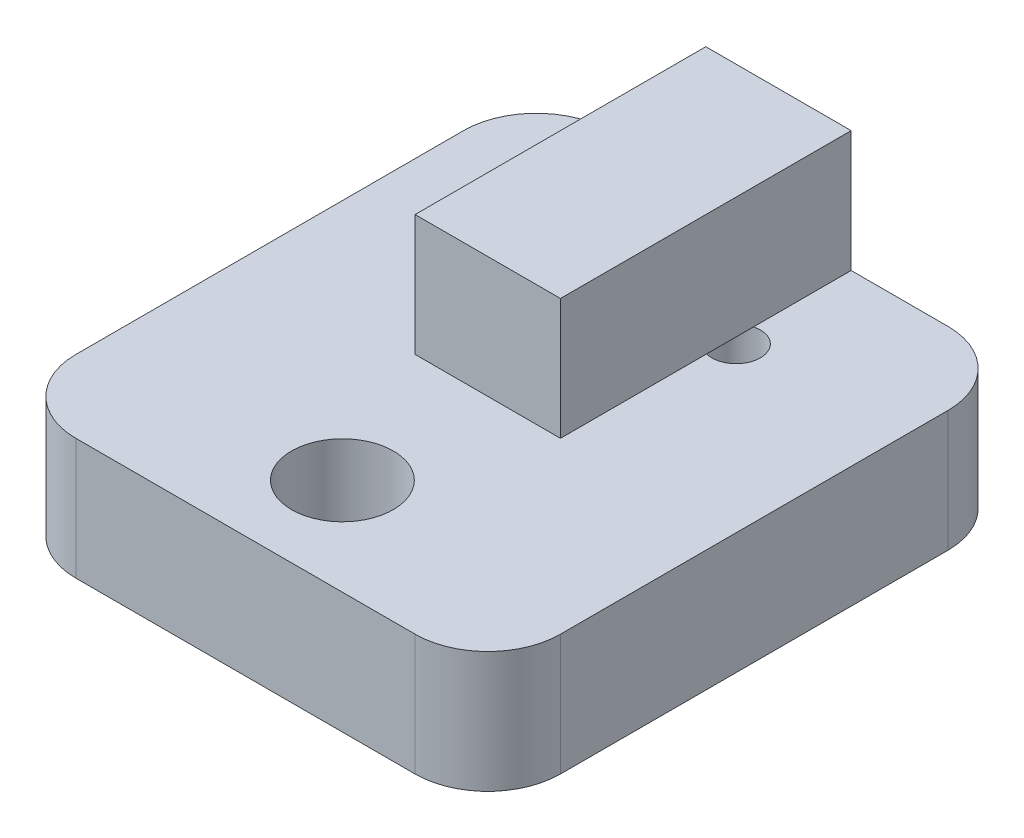
from build123d import *

# Parameters (mm, degrees)
SKETCH_1_R      = 2.1
EXTRUDE_1_DEPTH = 5
EXTRUDE_START   = 5
SKETCH_1_3_W    = 6
SKETCH_1_3_H    = 12
EXTRUDE_2_DEPTH = 5
FILLET_2_R      = 3


with BuildPart() as part:
    # 草图1 → 凸台-拉伸1 (new body)
    # profile 1 of 2: a face of its own
    with BuildSketch(Plane(origin=(0, 0, 0), x_dir=(1, 0, 0), z_dir=(0, 1, 0))):
        with BuildLine():
            Line((0, 22), (0, 0))
            Line((0, 0), (20, 0))
            Line((20, 0), (20, 22))
            Line((20, 22), (13, 22))
            Line((13, 22), (13, 17.968245837))
            ThreePointArc((13, 17.968245837), (13.862372436, 17.790569415), (14.25, 17))
            ThreePointArc((14.25, 17), (13.862372436, 16.209430585), (13, 16.031754163))
            Line((13, 16.031754163), (13, 10))
            Line((13, 10), (7, 10))
            Line((7, 10), (7, 16.031754163))
            ThreePointArc((7, 16.031754163), (5.75, 17), (7, 17.968245837))
            Line((7, 17.968245837), (7, 22))
            Line((7, 22), (0, 22))
        make_face()
        with Locations(Location((10, 4, 0), (0, 0, 270))):
            Circle(SKETCH_1_R, mode=Mode.SUBTRACT)
    # profile 2 of 2: a face of its own
    with BuildSketch(Plane(origin=(0, 0, 0), x_dir=(1, 0, 0), z_dir=(0, 1, 0))):
        with BuildLine():
            Line((13, 22), (7, 22))
            Line((7, 22), (7, 17.968245837))
            ThreePointArc((7, 17.968245837), (7.540569415, 17.612372436), (7.75, 17))
            ThreePointArc((7.75, 17), (7.540569415, 16.387627564), (7, 16.031754163))
            Line((7, 16.031754163), (7, 10))
            Line((7, 10), (13, 10))
            Line((13, 10), (13, 16.031754163))
            ThreePointArc((13, 16.031754163), (12.25, 17), (13, 17.968245837))
            Line((13, 17.968245837), (13, 22))
        make_face()
    extrude(amount=EXTRUDE_1_DEPTH)

    # 草图1<3> → 凸台-拉伸2 (add)
    with BuildSketch(Plane(origin=(0, 0, 0), x_dir=(1, 0, 0), z_dir=(0, 1, 0)).offset(EXTRUDE_START)):
        with Locations((10, 16)):
            Rectangle(SKETCH_1_3_W, SKETCH_1_3_H)
    extrude(amount=EXTRUDE_2_DEPTH)

    # 圆角2
    fillet_2_edges = [part.edges().sort_by_distance(p)[0] for p in [
        (20, 2.5, 0),
        (0, 2.5, 0),
        (0, 2.5, -22),
        (20, 2.5, -22),
    ]]
    fillet(fillet_2_edges, radius=FILLET_2_R)


solid = part.part
